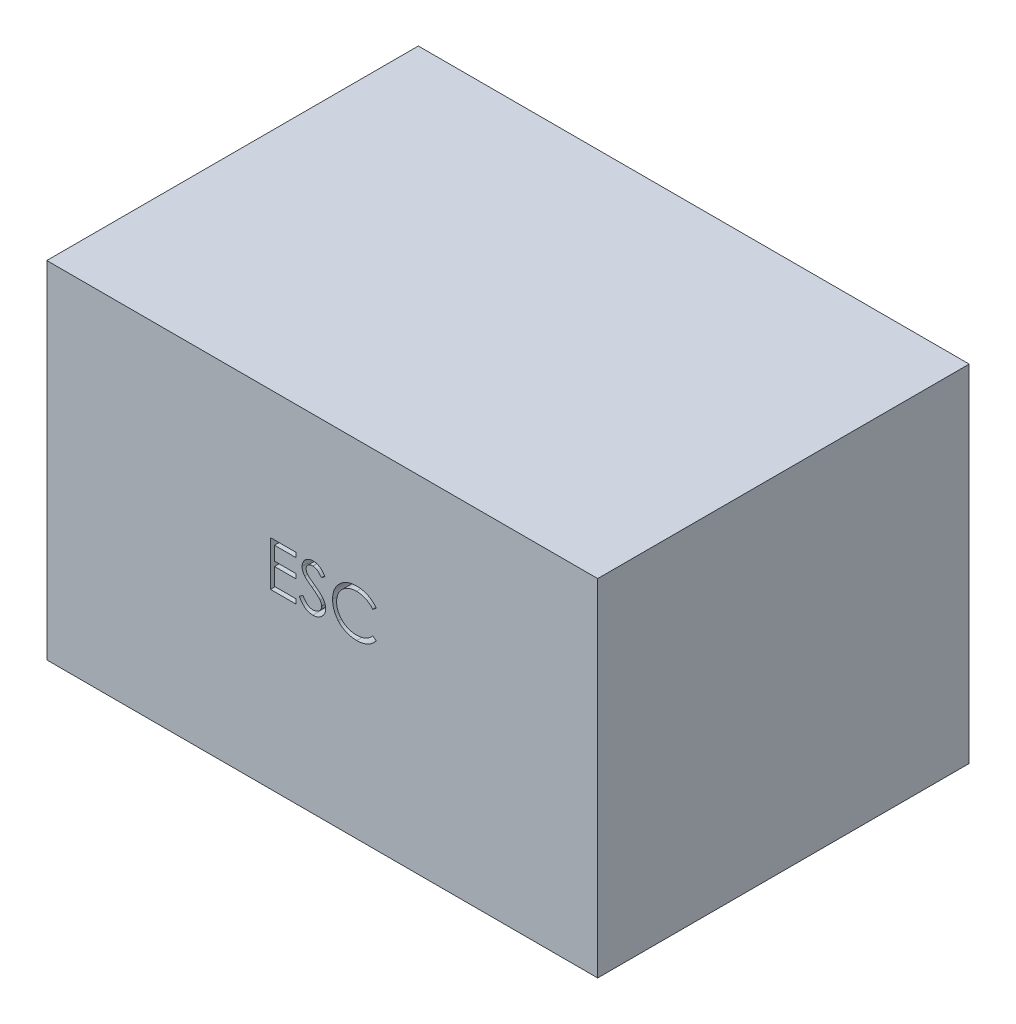
from build123d import *

# Parameters (mm, degrees)
SKETCH1_W           = 43
SKETCH1_H           = 29
BOSS_EXTRUDE1_DEPTH = 27
CUT_EXTRUDE1_DEPTH  = 12.7


with BuildPart() as part:
    # Sketch1 → Boss-Extrude1 (new body)
    with BuildSketch(Plane(origin=(0, 0, 0), x_dir=(1, 0, 0), z_dir=(0, 1, 0))):
        Rectangle(SKETCH1_W, SKETCH1_H)
    extrude(amount=BOSS_EXTRUDE1_DEPTH)

    # Sketch2 → Cut-Extrude1 (cut)
    with BuildSketch(Plane.XY.offset(14.5)):
        Polygon((-4.038461538, 17), (-2.064102564, 17), (-2.064102564, 16.641025641), (-3.724358974, 16.641025641), (-3.724358974, 15.564102564), (-2.064102564, 15.564102564), (-2.064102564, 15.205128205), (-3.724358974, 15.205128205), (-3.724358974, 13.858974359), (-2.064102564, 13.858974359), (-2.064102564, 13.5), (-4.038461538, 13.5), align=None)
        with BuildLine():
            Line((-1.794871795, 14.175180288), (-1.498998397, 14.352564103))
            add(Edge.make_bspline(
                [(-1.498998397, 14.352564103), (-1.47148016, 14.306499718), (-1.41875628, 14.218242134), (-1.33080492, 14.098984093), (-1.239672009, 13.997621937), (-1.144682676, 13.914745329), (-1.046416728, 13.849496442), (-0.944232674, 13.803294211), (-0.838474863, 13.774478235), (-0.766501042, 13.770978149), (-0.73056891, 13.769230769)],
                knots=[0, 0, 0, 0, 1.272034388, 2.437168799, 3.508375237, 4.49857839, 5.41946034, 6.295179144, 7.148887113, 8, 8, 8, 8], degree=3))
            add(Edge.make_bspline(
                [(-0.73056891, 13.769230769), (-0.69988205, 13.770085442), (-0.639045277, 13.771779832), (-0.549483034, 13.788060634), (-0.462501231, 13.813072763), (-0.379892594, 13.848893694), (-0.302796979, 13.89223218), (-0.235190284, 13.944578358), (-0.176744171, 14.003184563), (-0.128935056, 14.068567218), (-0.092255021, 14.138884367), (-0.064062952, 14.211060318), (-0.048417879, 14.286228886), (-0.046061125, 14.336839349), (-0.044871795, 14.362379808)],
                knots=[0, 0, 0, 0, 1.095163259, 2.171163733, 3.241058638, 4.321873601, 5.38011039, 6.391990106, 7.366004449, 8.327778327, 9.272591725, 10.192022065, 11.087607919, 12, 12, 12, 12], degree=3))
            add(Edge.make_bspline(
                [(-0.044871795, 14.362379808), (-0.046346106, 14.391520657), (-0.049343164, 14.450759747), (-0.074674644, 14.5381594), (-0.114523891, 14.62465197), (-0.151286534, 14.678153235), (-0.170372596, 14.705929487)],
                knots=[0, 0, 0, 0, 0.938893495, 1.908633276, 2.914225137, 4, 4, 4, 4], degree=3))
            add(Edge.make_bspline(
                [(-0.170372596, 14.705929487), (-0.18604321, 14.725976311), (-0.218941705, 14.768062109), (-0.275499217, 14.830707345), (-0.341865332, 14.895325764), (-0.415768886, 14.964384821), (-0.499901975, 15.034672617), (-0.59162949, 15.109540895), (-0.693293349, 15.186142472), (-0.764592845, 15.237515038), (-0.801382212, 15.264022436)],
                knots=[0, 0, 0, 0, 0.722233717, 1.516239348, 2.393582979, 3.351407094, 4.387010283, 5.505090956, 6.712668013, 8, 8, 8, 8], degree=3))
            add(Edge.make_bspline(
                [(-0.801382212, 15.264022436), (-0.838206208, 15.290251024), (-0.908610884, 15.340398086), (-1.007069467, 15.41482237), (-1.09511393, 15.482866239), (-1.172352946, 15.545170251), (-1.238752543, 15.601742856), (-1.294835954, 15.652040795), (-1.339174511, 15.697424356), (-1.363830092, 15.726865698), (-1.37489984, 15.740084135)],
                knots=[0, 0, 0, 0, 1.452282411, 2.77665338, 3.964542531, 5.026858415, 5.96415736, 6.766646006, 7.446254459, 8, 8, 8, 8], degree=3))
            add(Edge.make_bspline(
                [(-1.37489984, 15.740084135), (-1.390372385, 15.760685171), (-1.420801222, 15.801199875), (-1.460967227, 15.864524733), (-1.49510639, 15.929347998), (-1.521868722, 15.995843863), (-1.544404941, 16.063078792), (-1.559562872, 16.131930038), (-1.569054269, 16.202088656), (-1.570026255, 16.249302157), (-1.570512821, 16.272936699)],
                knots=[0, 0, 0, 0, 1.068054152, 2.10047183, 3.106115577, 4.101338837, 5.06977816, 6.043150881, 7.020423561, 8, 8, 8, 8], degree=3))
            add(Edge.make_bspline(
                [(-1.570512821, 16.272936699), (-1.569207612, 16.309966473), (-1.566625091, 16.383234537), (-1.544784574, 16.490265367), (-1.510311681, 16.592451785), (-1.462016793, 16.688782118), (-1.39975944, 16.776748099), (-1.327713465, 16.857361586), (-1.241901979, 16.925130168), (-1.147749356, 16.984342227), (-1.044692984, 17.030688152), (-0.93670208, 17.065649132), (-0.823605008, 17.08545839), (-0.747001874, 17.088301155), (-0.708133013, 17.08974359)],
                knots=[0, 0, 0, 0, 1.005424448, 1.989358655, 2.955360095, 3.929531133, 4.905563448, 5.876582895, 6.856512386, 7.866279853, 8.892233794, 9.918561126, 10.94386622, 12, 12, 12, 12], degree=3))
            add(Edge.make_bspline(
                [(-0.708133013, 17.08974359), (-0.666888913, 17.088321038), (-0.584867561, 17.085492037), (-0.464218345, 17.060894506), (-0.348057629, 17.020193834), (-0.254614364, 16.974005176), (-0.181481603, 16.92787376), (-0.12570887, 16.885853936), (-0.069191419, 16.837478827), (-0.011473364, 16.782619581), (0.046467295, 16.72077283), (0.105490747, 16.652362141), (0.165735016, 16.577805585), (0.204490876, 16.524581085), (0.224358974, 16.497295673)],
                knots=[0, 0, 0, 0, 1.286793592, 2.559021753, 3.825965368, 5.121522368, 5.803751409, 6.523245864, 7.299691795, 8.125521123, 9.008227632, 9.944561021, 10.946284179, 12, 12, 12, 12], degree=3))
            Line((0.224358974, 16.497295673), (-0.059595353, 16.282051282))
            add(Edge.make_bspline(
                [(-0.059595353, 16.282051282), (-0.076741285, 16.304139972), (-0.109760342, 16.346677626), (-0.159889829, 16.406248941), (-0.207138477, 16.460665421), (-0.253688877, 16.507930549), (-0.297082508, 16.550632682), (-0.33919955, 16.587192439), (-0.379433902, 16.617968034), (-0.430150812, 16.650811594), (-0.493868531, 16.683368098), (-0.573853067, 16.710917176), (-0.657439342, 16.727472238), (-0.714368973, 16.729661126), (-0.743189103, 16.730769231)],
                knots=[0, 0, 0, 0, 1.181633172, 2.275549214, 3.290209073, 4.226197932, 5.078386478, 5.862611352, 6.581680152, 7.217281963, 8.414376989, 9.595101626, 10.782541182, 12, 12, 12, 12], degree=3))
            add(Edge.make_bspline(
                [(-0.743189103, 16.730769231), (-0.779345625, 16.729557531), (-0.849070072, 16.727220882), (-0.948060308, 16.701700896), (-1.037154234, 16.661519036), (-1.113706799, 16.605204058), (-1.177443776, 16.538483065), (-1.223549234, 16.46170421), (-1.251299399, 16.376921808), (-1.254685679, 16.317780151), (-1.256410256, 16.287660256)],
                knots=[0, 0, 0, 0, 1.14458467, 2.207223713, 3.21896685, 4.227309161, 5.202851033, 6.127160689, 7.046193047, 8, 8, 8, 8], degree=3))
            add(Edge.make_bspline(
                [(-1.256410256, 16.287660256), (-1.25601713, 16.268908778), (-1.255230234, 16.231375158), (-1.244255436, 16.175923736), (-1.230156107, 16.120612397), (-1.207813475, 16.065689814), (-1.176968172, 16.010195455), (-1.136462996, 15.953173718), (-1.085449684, 15.894122009), (-1.046372671, 15.855714635), (-1.025741186, 15.835436699)],
                knots=[0, 0, 0, 0, 0.858281714, 1.717966888, 2.583508476, 3.4729293, 4.427298488, 5.488583878, 6.674047936, 8, 8, 8, 8], degree=3))
            add(Edge.make_bspline(
                [(-1.025741186, 15.835436699), (-1.018079813, 15.828599673), (-0.999878146, 15.812356465), (-0.966602221, 15.785764184), (-0.922659422, 15.752961412), (-0.869197221, 15.712374095), (-0.805229859, 15.665292633), (-0.730750303, 15.612319021), (-0.64658877, 15.551733562), (-0.586866855, 15.509376021), (-0.555288462, 15.486979167)],
                knots=[0, 0, 0, 0, 0.420754252, 0.999615792, 1.744751191, 2.668019286, 3.750313428, 4.999500688, 6.413464383, 8, 8, 8, 8], degree=3))
            add(Edge.make_bspline(
                [(-0.555288462, 15.486979167), (-0.517302548, 15.459337807), (-0.443748092, 15.405814145), (-0.339090512, 15.325398465), (-0.244196704, 15.246750697), (-0.1587335, 15.17037309), (-0.081856592, 15.096844997), (-0.014418871, 15.025281816), (0.044266809, 14.956196244), (0.107446028, 14.867623668), (0.172003847, 14.758842584), (0.227445355, 14.625564345), (0.262403702, 14.491768025), (0.266975217, 14.401841188), (0.269230769, 14.357471955)],
                knots=[0, 0, 0, 0, 1.163667725, 2.253281268, 3.268753668, 4.215851969, 5.092017293, 5.902905408, 6.650798638, 7.335211899, 8.59617414, 9.77448103, 10.901945474, 12, 12, 12, 12], degree=3))
            add(Edge.make_bspline(
                [(0.269230769, 14.357471955), (0.268573631, 14.32609359), (0.267272116, 14.263946206), (0.252311202, 14.17269113), (0.230391537, 14.08406026), (0.197354303, 13.999149147), (0.157031145, 13.916404385), (0.105864897, 13.837996484), (0.046557212, 13.762190086), (-0.021476553, 13.691006594), (-0.095922455, 13.625660398), (-0.17460615, 13.567531337), (-0.257656423, 13.519063014), (-0.344622739, 13.479512172), (-0.435525076, 13.448578654), (-0.53033286, 13.426165785), (-0.629202371, 13.412410074), (-0.696402853, 13.410982313), (-0.73056891, 13.41025641)],
                knots=[0, 0, 0, 0, 0.983748083, 1.948392443, 2.894712957, 3.844097841, 4.80183111, 5.778335162, 6.776009319, 7.81870978, 8.863265674, 9.881300176, 10.883814829, 11.87499822, 12.874611388, 13.892143829, 14.928324115, 16, 16, 16, 16], degree=3))
            add(Edge.make_bspline(
                [(-0.73056891, 13.41025641), (-0.757004253, 13.410767592), (-0.809542013, 13.411783517), (-0.887251495, 13.420764798), (-0.963391084, 13.433471901), (-1.037005366, 13.453645971), (-1.109042778, 13.478122948), (-1.179190013, 13.508261281), (-1.247481066, 13.544378482), (-1.314298649, 13.585673507), (-1.379472824, 13.633731252), (-1.442392292, 13.689704748), (-1.505121477, 13.752050253), (-1.565808874, 13.822460816), (-1.625682018, 13.899798899), (-1.683560427, 13.984788083), (-1.740642145, 14.076965436), (-1.776457613, 14.141830522), (-1.794871795, 14.175180288)],
                knots=[0, 0, 0, 0, 0.915332311, 1.819136955, 2.706846663, 3.586547465, 4.459518054, 5.340707479, 6.227863349, 7.133153174, 8.059268498, 9.028702269, 10.047606654, 11.120612155, 12.245963614, 13.433783089, 14.680604001, 16, 16, 16, 16], degree=3))
        make_face()
        with BuildLine():
            Line((4.217948718, 16.357772436), (3.943108974, 16.147435897))
            add(Edge.make_bspline(
                [(3.943108974, 16.147435897), (3.923503086, 16.170801867), (3.884555639, 16.217218783), (3.821896437, 16.282398327), (3.756594794, 16.343463589), (3.688675673, 16.400705469), (3.616916553, 16.452122234), (3.543055754, 16.500393337), (3.465857709, 16.543661075), (3.359105975, 16.596124061), (3.219458126, 16.650870216), (3.043663287, 16.696773448), (2.860152189, 16.725994623), (2.734954589, 16.729159465), (2.671274038, 16.730769231)],
                knots=[0, 0, 0, 0, 0.757959112, 1.505699292, 2.245454638, 2.979532153, 3.711538275, 4.438200793, 5.171680507, 5.909471876, 7.393775596, 8.890124382, 10.418191784, 12, 12, 12, 12], degree=3))
            add(Edge.make_bspline(
                [(2.671274038, 16.730769231), (2.636190739, 16.730365268), (2.566349747, 16.729561092), (2.462701273, 16.718951967), (2.360988222, 16.704040757), (2.261276756, 16.681915434), (2.163693797, 16.653942815), (2.067601395, 16.620517401), (1.974390795, 16.579162561), (1.882772557, 16.533454301), (1.794993346, 16.481826856), (1.711938298, 16.425513504), (1.63391033, 16.365144408), (1.560847718, 16.300493302), (1.49267577, 16.231851341), (1.429888459, 16.158487), (1.372703049, 16.080634826), (1.319986024, 15.999321419), (1.27277329, 15.914783627), (1.233243411, 15.826708556), (1.198238289, 15.736604453), (1.170539046, 15.643453293), (1.148614529, 15.547910527), (1.133486866, 15.449719739), (1.122998395, 15.349086059), (1.122198218, 15.280876747), (1.121794872, 15.246494391)],
                knots=[0, 0, 0, 0, 1.054917814, 2.100044995, 3.131103042, 4.146048494, 5.169673617, 6.183595914, 7.203665975, 8.234915748, 9.262203917, 10.264457458, 11.251630812, 12.227803204, 13.197192746, 14.159520551, 15.12972552, 16.100847026, 17.073214652, 18.039054194, 19.002613845, 19.979014051, 20.95965708, 21.949030935, 22.966165397, 24, 24, 24, 24], degree=3))
            add(Edge.make_bspline(
                [(1.121794872, 15.246494391), (1.123056691, 15.194763071), (1.125534105, 15.093195486), (1.147582439, 14.944424876), (1.18108753, 14.801904202), (1.231303107, 14.66652436), (1.293222158, 14.536616002), (1.371462769, 14.414377148), (1.462079307, 14.297960584), (1.566353726, 14.190117636), (1.680759542, 14.091603911), (1.803507454, 14.004853329), (1.934291742, 13.932538447), (2.071668372, 13.8723625), (2.216694486, 13.826105772), (2.369109288, 13.793541649), (2.528581283, 13.772299468), (2.637550683, 13.77026578), (2.693008814, 13.769230769)],
                knots=[0, 0, 0, 0, 1.029171465, 2.020641659, 2.987623507, 3.938342917, 4.889210282, 5.84687017, 6.821220943, 7.821438502, 8.827599549, 9.822697543, 10.807740252, 11.797342354, 12.80366471, 13.83203677, 14.896651826, 16, 16, 16, 16], degree=3))
            add(Edge.make_bspline(
                [(2.693008814, 13.769230769), (2.754111503, 13.770919549), (2.874376212, 13.774243472), (3.050744238, 13.802402721), (3.219580004, 13.848060638), (3.380892591, 13.911958561), (3.534227237, 13.995023849), (3.679823897, 14.095721726), (3.817805468, 14.215010059), (3.90077675, 14.306093187), (3.943108974, 14.352564103)],
                knots=[0, 0, 0, 0, 1.028121516, 2.023589091, 2.998037872, 3.967518031, 4.937445131, 5.927275754, 6.942489185, 8, 8, 8, 8], degree=3))
            Line((3.943108974, 14.352564103), (4.217948718, 14.144330929))
            add(Edge.make_bspline(
                [(4.217948718, 14.144330929), (4.195830608, 14.115792478), (4.151700333, 14.058852271), (4.080242316, 13.978580562), (4.004965018, 13.903076526), (3.925309308, 13.832948905), (3.842191517, 13.766794439), (3.754119204, 13.706492608), (3.662250172, 13.651201724), (3.566895693, 13.600574799), (3.46815708, 13.555657552), (3.366152645, 13.517203784), (3.26132207, 13.484078895), (3.153660561, 13.456826958), (3.042944805, 13.435555874), (2.92957433, 13.421336199), (2.813304455, 13.411594285), (2.734863034, 13.410706369), (2.695112179, 13.41025641)],
                knots=[0, 0, 0, 0, 0.986787822, 1.968848986, 2.935600012, 3.899624008, 4.868462664, 5.837806735, 6.815139263, 7.798259679, 8.787526145, 9.778297419, 10.776456485, 11.791383307, 12.812564526, 13.85620153, 14.913611965, 16, 16, 16, 16], degree=3))
            add(Edge.make_bspline(
                [(2.695112179, 13.41025641), (2.657468512, 13.410518403), (2.583032822, 13.411036461), (2.473134071, 13.419428628), (2.36614449, 13.430878365), (2.262369864, 13.448118496), (2.161243889, 13.468462836), (2.063683305, 13.495734093), (1.968728094, 13.526283259), (1.876759753, 13.562188246), (1.787700054, 13.602704429), (1.701836242, 13.648495987), (1.61920781, 13.699177852), (1.539002389, 13.753632863), (1.462404805, 13.813610164), (1.38875128, 13.878276799), (1.317628804, 13.94741481), (1.273626119, 13.997269663), (1.251502404, 14.022335737)],
                knots=[0, 0, 0, 0, 1.114604814, 2.203992996, 3.262667896, 4.300477797, 5.318619304, 6.316056647, 7.298880507, 8.271930387, 9.238335007, 10.195173496, 11.151986948, 12.108099108, 13.064862484, 14.031167946, 15.010108607, 16, 16, 16, 16], degree=3))
            add(Edge.make_bspline(
                [(1.251502404, 14.022335737), (1.21606676, 14.065876926), (1.145623284, 14.152433637), (1.0554976, 14.292719618), (0.978350045, 14.439187827), (0.915974124, 14.592607755), (0.867211391, 14.752635143), (0.833430196, 14.919350657), (0.811478591, 15.092598599), (0.808968302, 15.210435388), (0.807692308, 15.270332532)],
                knots=[0, 0, 0, 0, 0.994628077, 1.977248131, 2.950237994, 3.925870899, 4.908910175, 5.911660606, 6.938484602, 8, 8, 8, 8], degree=3))
            add(Edge.make_bspline(
                [(0.807692308, 15.270332532), (0.809247501, 15.333287986), (0.812307247, 15.45714891), (0.838303043, 15.638922863), (0.880121839, 15.813074262), (0.939518728, 15.979278007), (1.014824079, 16.138408287), (1.107850693, 16.289249492), (1.217517835, 16.432766292), (1.342965403, 16.566781043), (1.480532738, 16.689320396), (1.627851552, 16.797126599), (1.784633499, 16.886844115), (1.949151351, 16.961840278), (2.122637032, 17.019484741), (2.304720401, 17.059837928), (2.495059316, 17.084955044), (2.624921742, 17.088130252), (2.690905449, 17.08974359)],
                knots=[0, 0, 0, 0, 1.032925535, 2.032216505, 3.007276963, 3.968222605, 4.92396291, 5.891752235, 6.871517503, 7.883894988, 8.900124299, 9.891468569, 10.874487609, 11.85992873, 12.854644235, 13.869047385, 14.917252991, 16, 16, 16, 16], degree=3))
            add(Edge.make_bspline(
                [(2.690905449, 17.08974359), (2.731119921, 17.089261452), (2.810720418, 17.088307108), (2.92847307, 17.079000965), (3.043115397, 17.063487359), (3.154726379, 17.042371289), (3.263848996, 17.016163968), (3.369649236, 16.98202367), (3.472747923, 16.942987138), (3.572494831, 16.898028672), (3.668411382, 16.847561931), (3.7604677, 16.792146307), (3.847932559, 16.731850502), (3.931421407, 16.667187326), (4.009537618, 16.596788767), (4.084499097, 16.522591171), (4.153760175, 16.442457347), (4.19651337, 16.386052413), (4.217948718, 16.357772436)],
                knots=[0, 0, 0, 0, 1.096760587, 2.17092713, 3.219439832, 4.250915756, 5.268269357, 6.278326846, 7.281116186, 8.274029601, 9.260640565, 10.235837813, 11.203064059, 12.156899882, 13.114053108, 14.069676657, 15.032185724, 16, 16, 16, 16], degree=3))
        make_face()
    extrude(amount=-CUT_EXTRUDE1_DEPTH, mode=Mode.SUBTRACT)


solid = part.part
